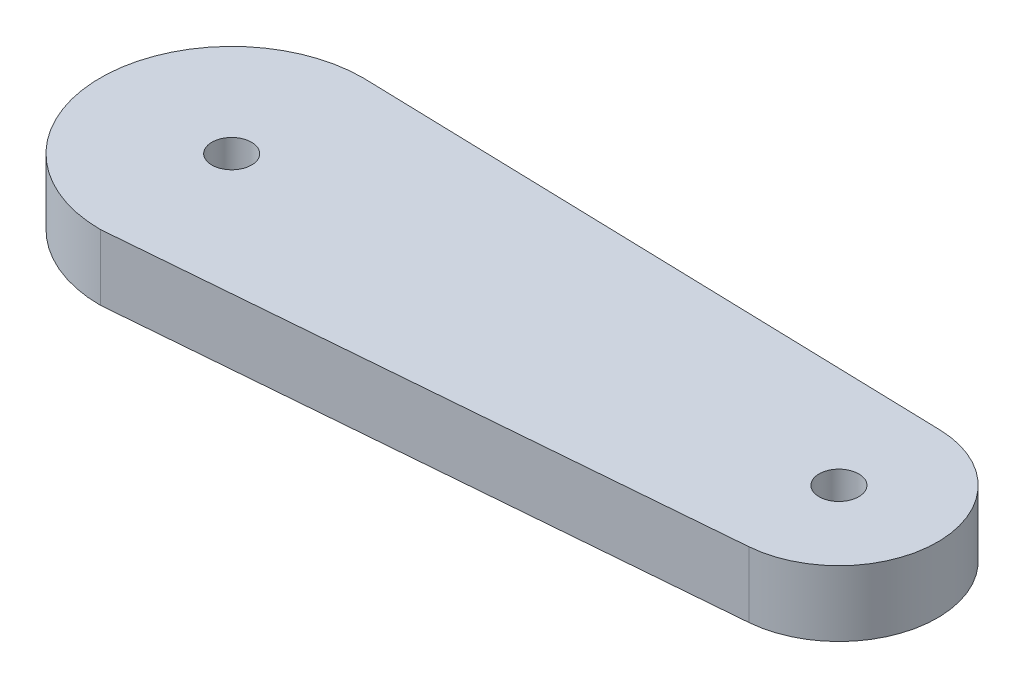
from build123d import *

# Parameters (mm, degrees)
BOSS_EXTRUDE1_DEPTH = 5
CUT_EXTRUDE1_REACH  = 55.66
SKETCH2_R           = 1.51


with BuildPart() as part:
    # Sketch1 → Boss-Extrude1 (new body)
    with BuildSketch(Plane(origin=(0, 0, 0), x_dir=(1, 0, 0), z_dir=(0, 1, 0))):
        with BuildLine():
            ThreePointArc((0, 10), (-10, 0), (0, -10))
            Line((0, -10), (45.601011206, -6.227938292))
            ThreePointArc((45.601011206, -6.227938292), (52.479923025, 1.451771759), (45.191159304, 8.743636932))
            Line((45.191159304, 8.743636932), (0, 10))
        make_face()
    extrude(amount=BOSS_EXTRUDE1_DEPTH)

    # Sketch2 → Cut-Extrude1 (cut, up to next)
    with BuildSketch(Plane(origin=(0, 5, 0), x_dir=(1, 0, 0), z_dir=(0, 1, 0)), mode=Mode.PRIVATE) as cut_extrude1_sk1:
        with Locations(Location((0, 0, 0), (0, 0, 270))):
            Circle(SKETCH2_R)
    cut_extrude1_tool1 = extrude(cut_extrude1_sk1.sketch, amount=-CUT_EXTRUDE1_REACH, mode=Mode.PRIVATE) & part.part
    # Sketch2 → Cut-Extrude1 (cut, up to next)
    with BuildSketch(Plane(origin=(0, 5, 0), x_dir=(1, 0, 0), z_dir=(0, 1, 0)), mode=Mode.PRIVATE) as cut_extrude1_sk2:
        with Locations(Location((44.98273173, 1.246533628, 0), (0, 0, 270))):
            Circle(SKETCH2_R)
    cut_extrude1_tool2 = extrude(cut_extrude1_sk2.sketch, amount=-CUT_EXTRUDE1_REACH, mode=Mode.PRIVATE) & part.part
    add(cut_extrude1_tool1.solids().sort_by_distance((0, 5, 0))[0], mode=Mode.SUBTRACT)
    add(cut_extrude1_tool2.solids().sort_by_distance((44.982732, 5, -1.246534))[0], mode=Mode.SUBTRACT)


solid = part.part
